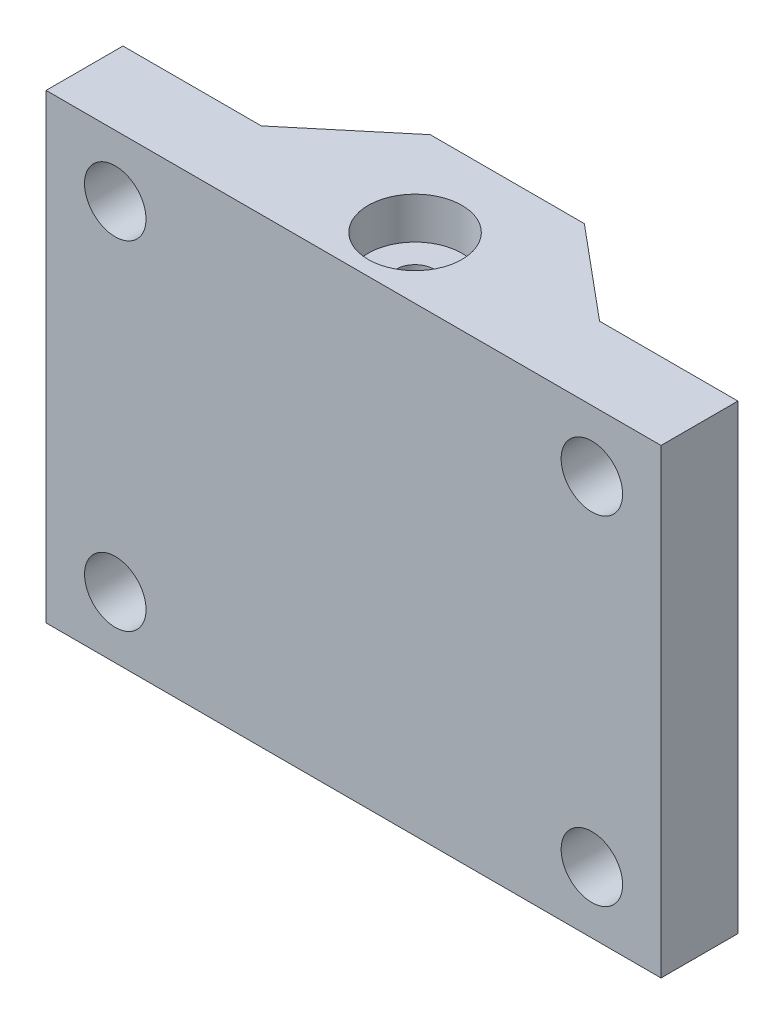
from build123d import *

# Parameters (mm, degrees)
BOSS_EXTRUDE2_DEPTH = 30
SKETCH2_R           = 1.25
CUT_EXTRUDE1_DEPTH  = 10
SKETCH4_R           = 2
CUT_EXTRUDE5_DEPTH  = 37.400549446
SKETCH5_R           = 3.05
CUT_EXTRUDE6_DEPTH  = 2.7


with BuildPart() as part:
    # Sketch1 → Boss-Extrude2 (new body)
    with BuildSketch(Plane(origin=(0, 0, 0), x_dir=(1, 0, 0), z_dir=(0, 1, 0))):
        Polygon((0, 0), (-20, 0), (-20, 5), (-11, 5), (-5.01141852, 10), (5.01141852, 10), (11, 5), (20, 5), (20, 0), align=None)
    extrude(amount=BOSS_EXTRUDE2_DEPTH)

    # Sketch2 → Cut-Extrude1 (cut)
    with BuildSketch(Plane(origin=(0, 30, 0), x_dir=(1, 0, 0), z_dir=(0, 1, 0))):
        with Locations(Location((0, 4, 0), (0, 0, 270))):
            Circle(SKETCH2_R)
    extrude(amount=-CUT_EXTRUDE1_DEPTH, mode=Mode.SUBTRACT)

    # Sketch4 → Cut-Extrude5 (cut, through all)
    with BuildSketch(Plane(origin=(0, 0, -5), x_dir=(-1, 0, 0), z_dir=(0, 0, -1))):
        with Locations((-15.5, 4)):
            Circle(SKETCH4_R)
        with Locations(Location((-15.5, 26, 0), (0, 0, 180))):
            Circle(SKETCH4_R)
        with Locations(Location((15.5, 4, 0), (0, 0, 180))):
            Circle(SKETCH4_R)
        with Locations((15.5, 26)):
            Circle(SKETCH4_R)
    extrude(amount=-CUT_EXTRUDE5_DEPTH, mode=Mode.SUBTRACT)

    # Sketch5 → Cut-Extrude6 (cut)
    with BuildSketch(Plane(origin=(0, 30, 0), x_dir=(1, 0, 0), z_dir=(0, 1, 0))):
        with Locations(Location((0, 4, 0), (0, 0, 270))):
            Circle(SKETCH5_R)
    extrude(amount=-CUT_EXTRUDE6_DEPTH, mode=Mode.SUBTRACT)


solid = part.part
